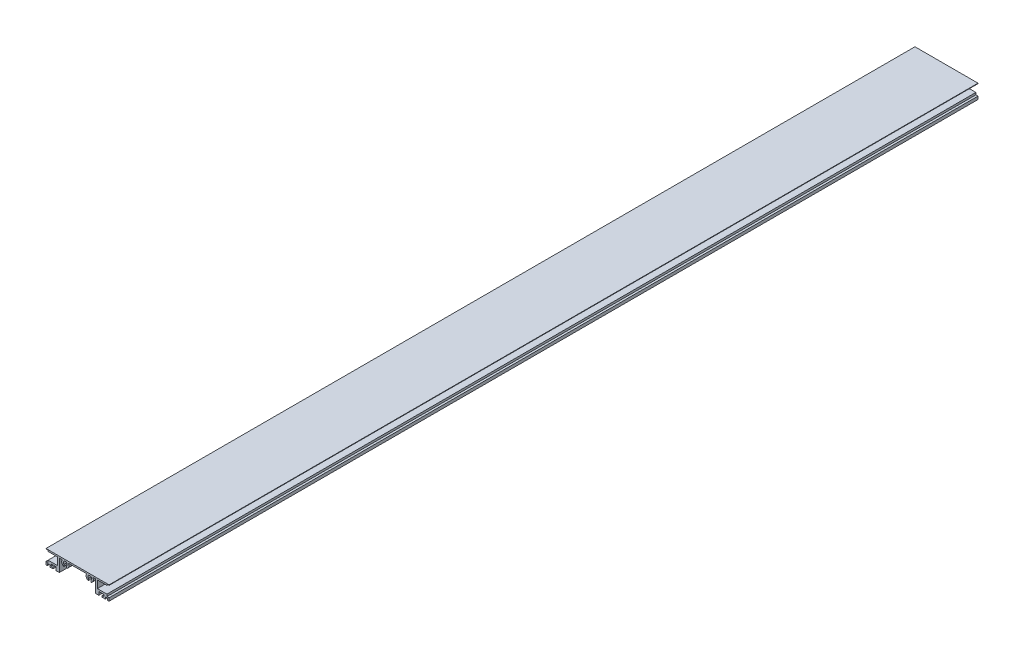
from build123d import *

# Parameters (mm, degrees)
ESTRUSIONE_ESTRUSIONE1_DEPTH = 900
SCHIZZO2_W                   = 3.5
SCHIZZO2_H                   = 4.6
TAGLIO_ESTRUSIONE1_DEPTH     = 901.700850727


with BuildPart() as part:
    # Schizzo1 → Estrusione-Estrusione1 (new body)
    with BuildSketch(Plane.XY):
        with BuildLine():
            Line((-30.15, 14), (-32.65, 14))
            Line((-32.65, 14), (-32.65, 8.9))
            Line((-32.65, 8.9), (-30.45, 8.9))
            Line((-30.45, 8.9), (-30.45, 7.8))
            Line((-30.45, 7.8), (-20.55, 7.8))
            Line((-20.55, 7.8), (-20.55, 0))
            Line((-20.55, 0), (-30.45, 0))
            Line((-30.45, 0), (-30.45, -2.2))
            Line((-30.45, -2.2), (-32.65, -2.2))
            Line((-32.65, -2.2), (-32.65, -5.3))
            Line((-32.65, -5.3), (-31.15, -5.3))
            Line((-31.15, -5.3), (-31.15, -3.3))
            Line((-31.15, -3.3), (-28.75, -3.3))
            Line((-28.75, -3.3), (-28.75, -5.3))
            Line((-28.75, -5.3), (-25.45, -5.3))
            Line((-25.45, -5.3), (-25.45, -3.8))
            Line((-25.45, -3.8), (-27.25, -3.8))
            Line((-27.25, -3.8), (-27.25, -1.8))
            Line((-27.25, -1.8), (-22.05, -1.8))
            Line((-22.05, -1.8), (-22.05, -5.3))
            Line((-22.05, -5.3), (-18.85, -5.3))
            Line((-18.85, -5.3), (-18.85, 7.8))
            Line((-18.85, 7.8), (-15.821542758, 7.8))
            ThreePointArc((-15.821542758, 7.8), (-16.273540604, 4.846345824), (-14.423395659, 2.5))
            Line((-14.423395659, 2.5), (-14.074102014, 2.5))
            Line((-14.074102014, 2.5), (-14.074102014, 4.405182935))
            ThreePointArc((-14.074102014, 4.405182935), (-12.647585955, 7.8), (-11.221069895, 4.405182935))
            Line((-11.221069895, 4.405182935), (-11.221069895, 2.5))
            Line((-11.221069895, 2.5), (-10.87177625, 2.5))
            ThreePointArc((-10.87177625, 2.5), (-9.021631305, 4.846345824), (-9.473629151, 7.8))
            Line((-9.473629151, 7.8), (0, 7.8))
            Line((0, 7.8), (0, 9.4))
            Line((0, 9.4), (-29.15, 9.4))
            Line((-29.15, 9.4), (-29.15, 10.5))
            Line((-29.15, 10.5), (-30.15, 10.5))
            Line((-30.15, 10.5), (-30.15, 14))
        make_face()
        with BuildLine():
            Line((29.15, 9.4), (0, 9.4))
            Line((0, 9.4), (0, 7.8))
            Line((0, 7.8), (9.473629151, 7.8))
            ThreePointArc((9.473629151, 7.8), (9.021631305, 4.846345824), (10.87177625, 2.5))
            Line((10.87177625, 2.5), (11.221069895, 2.5))
            Line((11.221069895, 2.5), (11.221069895, 4.405182935))
            ThreePointArc((11.221069895, 4.405182935), (12.647585955, 7.8), (14.074102014, 4.405182935))
            Line((14.074102014, 4.405182935), (14.074102014, 2.5))
            Line((14.074102014, 2.5), (14.423395659, 2.5))
            ThreePointArc((14.423395659, 2.5), (16.273540604, 4.846345824), (15.821542758, 7.8))
            Line((15.821542758, 7.8), (18.85, 7.8))
            Line((18.85, 7.8), (18.85, -5.3))
            Line((18.85, -5.3), (22.05, -5.3))
            Line((22.05, -5.3), (22.05, -1.8))
            Line((22.05, -1.8), (27.25, -1.8))
            Line((27.25, -1.8), (27.25, -3.8))
            Line((27.25, -3.8), (25.45, -3.8))
            Line((25.45, -3.8), (25.45, -5.3))
            Line((25.45, -5.3), (28.75, -5.3))
            Line((28.75, -5.3), (28.75, -3.3))
            Line((28.75, -3.3), (31.15, -3.3))
            Line((31.15, -3.3), (31.15, -5.3))
            Line((31.15, -5.3), (32.65, -5.3))
            Line((32.65, -5.3), (32.65, -2.2))
            Line((32.65, -2.2), (30.45, -2.2))
            Line((30.45, -2.2), (30.45, 0))
            Line((30.45, 0), (20.55, 0))
            Line((20.55, 0), (20.55, 7.8))
            Line((20.55, 7.8), (30.45, 7.8))
            Line((30.45, 7.8), (30.45, 8.9))
            Line((30.45, 8.9), (32.65, 8.9))
            Line((32.65, 8.9), (32.65, 14))
            Line((32.65, 14), (30.15, 14))
            Line((30.15, 14), (30.15, 10.5))
            Line((30.15, 10.5), (29.15, 10.5))
            Line((29.15, 10.5), (29.15, 9.4))
        make_face()
    extrude(amount=ESTRUSIONE_ESTRUSIONE1_DEPTH)

    # Schizzo2 → Taglio-Estrusione1 (cut, through all)
    with BuildSketch(Plane.XY.offset(900)):
        with Locations((30.9, 11.7)):
            Rectangle(SCHIZZO2_W, SCHIZZO2_H)
    taglio_estrusione1 = extrude(amount=-TAGLIO_ESTRUSIONE1_DEPTH, mode=Mode.SUBTRACT)

    # Specchia1: Taglio-Estrusione1 across plane
    add(taglio_estrusione1.mirror(Plane(origin=(0, 0, 0), x_dir=(0, 0, 1), z_dir=(1, 0, 0))), mode=Mode.SUBTRACT)


solid = part.part
